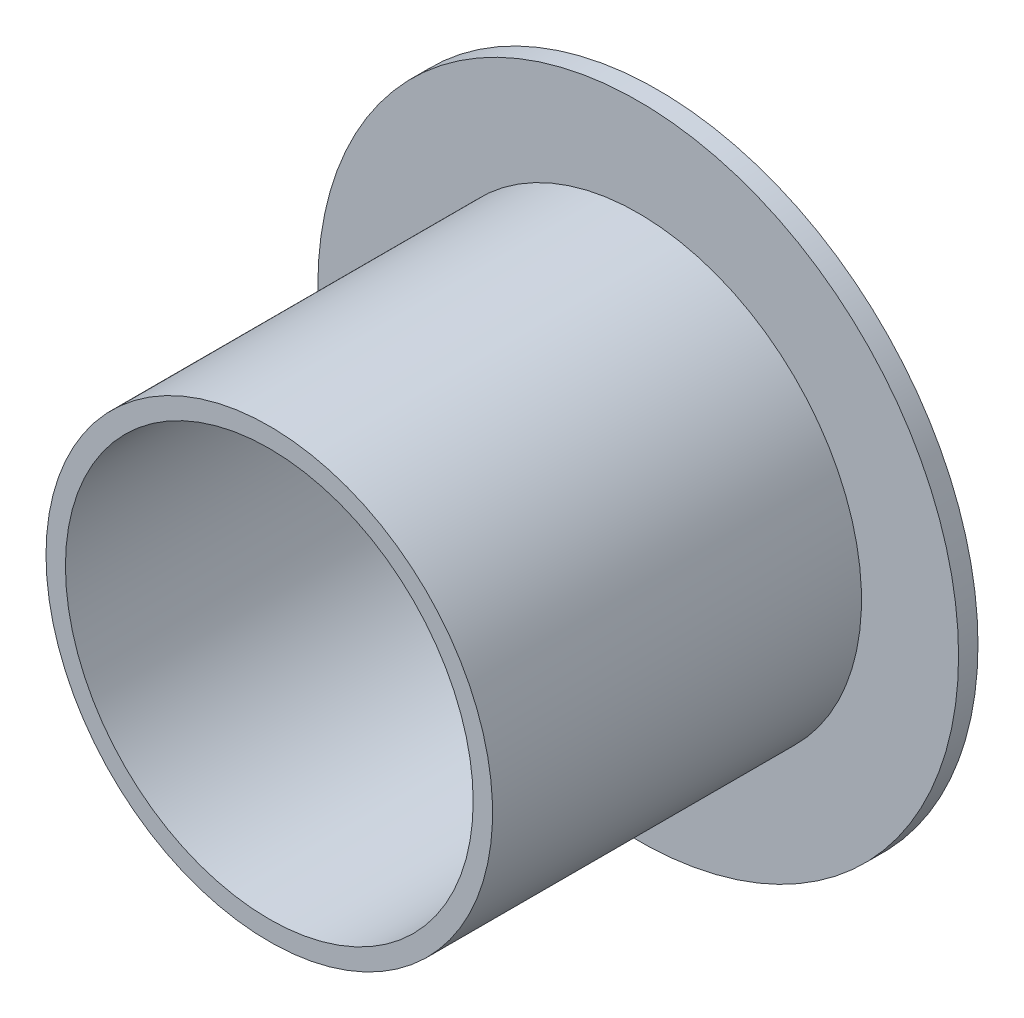
from build123d import *


with BuildPart() as part:
    # 草图1 → 旋转1 (revolve)
    with BuildSketch(Plane(origin=(0, 0, 0), x_dir=(1, 0, 0), z_dir=(0, 1, 0)), mode=Mode.PRIVATE) as revolve_1_sk:
        Polygon((0, 0), (6, 0), (6, -1), (1, -1), (1, -20), (0, -20), align=None)
    revolve(revolve_1_sk.sketch.rotate(Axis((-10.5, 0, 0), (0, 0, 1)), 180), axis=Axis((-10.5, 0, 0), (0, 0, 1)))


solid = part.part
